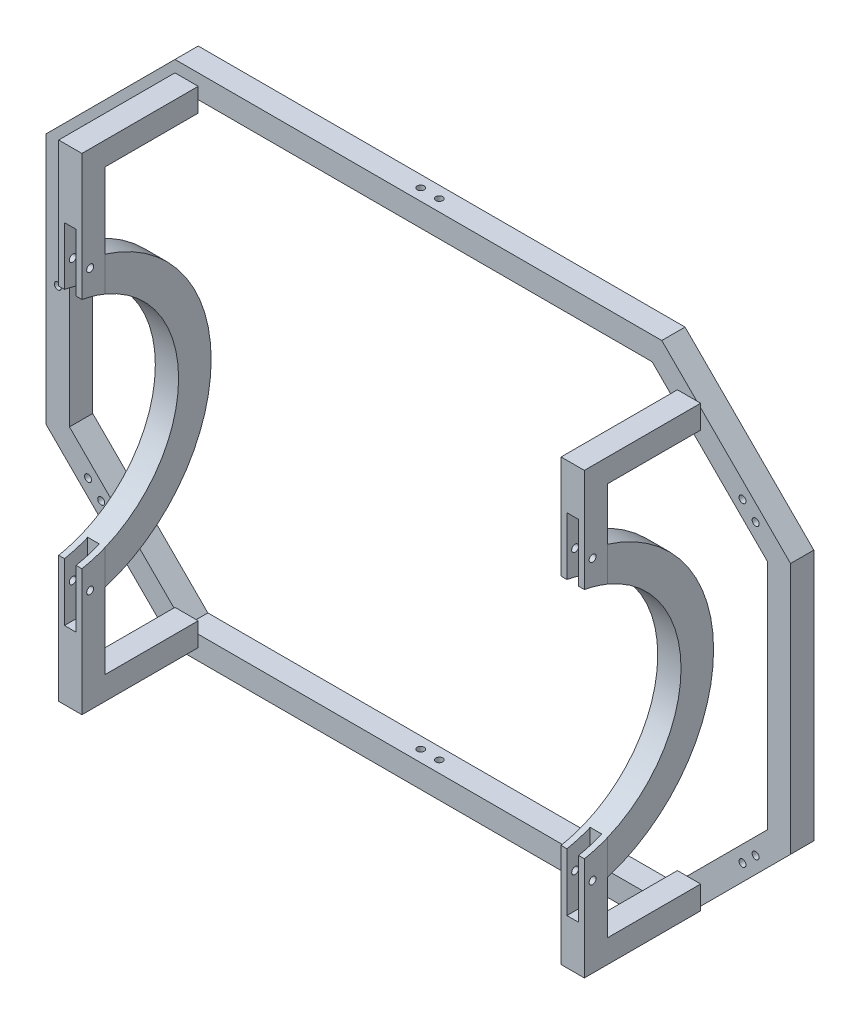
from build123d import *

# Parameters (mm, degrees)
Y_KSEKLIK_EKSTR_ZYON2_DEPTH = 10
IZIM3_W                     = 10
IZIM3_H                     = 40
Y_KSEKLIK_EKSTR_ZYON3_DEPTH = 10
IZIM4_W                     = 10
IZIM4_H                     = 104.5
Y_KSEKLIK_EKSTR_ZYON4_DEPTH = 10
IZIM6_W                     = 10
IZIM6_H                     = 50
Y_KSEKLIK_EKSTR_ZYON5_DEPTH = 10
IZIM7_W                     = 10
IZIM7_H                     = 94.5
Y_KSEKLIK_EKSTR_ZYON6_DEPTH = 10
IZIM8_R                     = 1.5
KES_EKSTR_ZYON1_DEPTH       = 35
IZIM9_R                     = 1.5
KES_EKSTR_ZYON2_DEPTH       = 265.5
IZIM12_R                    = 51
KES_EKSTR_ZYON4_DEPTH       = 338
Y_KSEKLIK_EKSTR_ZYON7_DEPTH = 5
Y_KSEKLIK_EKSTR_ZYON8_DEPTH = 5
IZIM21_W                    = 13.275114184
IZIM21_H                    = 150
KES_EKSTR_ZYON5_DEPTH       = 2.5
IZIM22_W                    = 15.470706389
IZIM22_H                    = 150
KES_EKSTR_ZYON6_DEPTH       = 2.5
IZIM23_R                    = 1.5
KES_EKSTR_ZYON7_DEPTH       = 242


with BuildPart() as part:
    # Çizim1 → Yükseklik-Ekstrüzyon2 (new body)
    with BuildSketch(Plane.XY):
        Polygon((-160, 54.142135624), (-104.644660941, 109.497474683), (104.644660941, 109.497474683), (160, 54.142135624), (160, -54.142135624), (104.644660941, -109.497474683), (-104.644660941, -109.497474683), (-160, -54.142135624), align=None)
        Polygon((-150, 50), (-150, -50), (-100.502525317, -99.497474683), (100.502525317, -99.497474683), (150, -50), (150, 50), (100.502525317, 99.497474683), (-100.502525317, 99.497474683), align=None, mode=Mode.SUBTRACT)
    extrude(amount=Y_KSEKLIK_EKSTR_ZYON2_DEPTH)

    # Çizim3 → Yükseklik-Ekstrüzyon3 (add)
    with BuildSketch(Plane(origin=(0, -104.5, 0), x_dir=(1, 0, 0), z_dir=(0, 1, 0))):
        with Locations((-99.644660941, -30)):
            Rectangle(IZIM3_W, IZIM3_H)
    y_kseklik_ekstr_zyon3 = extrude(amount=Y_KSEKLIK_EKSTR_ZYON3_DEPTH)

    # Çizim4 → Yükseklik-Ekstrüzyon4 (add)
    with BuildSketch(Plane.XY.offset(50)):
        with Locations((-99.644660941, -52.25)):
            Rectangle(IZIM4_W, IZIM4_H)
    y_kseklik_ekstr_zyon4 = extrude(amount=Y_KSEKLIK_EKSTR_ZYON4_DEPTH)

    # Çizim6 → Yükseklik-Ekstrüzyon5 (add)
    with BuildSketch(Plane(origin=(0, -94.5, 0), x_dir=(1, 0, 0), z_dir=(0, 1, 0))):
        with Locations((116.355339059, -35)):
            Rectangle(IZIM6_W, IZIM6_H)
    y_kseklik_ekstr_zyon5 = extrude(amount=Y_KSEKLIK_EKSTR_ZYON5_DEPTH)

    # Çizim7 → Yükseklik-Ekstrüzyon6 (add)
    with BuildSketch(Plane.XY.offset(50)):
        with Locations((116.355339059, -47.25)):
            Rectangle(IZIM7_W, IZIM7_H)
    y_kseklik_ekstr_zyon6 = extrude(amount=Y_KSEKLIK_EKSTR_ZYON6_DEPTH)

    # Aynalama1: Yükseklik-Ekstrüzyon3, Yükseklik-Ekstrüzyon4, Yükseklik-Ekstrüzyon5, Yükseklik-Ekstrüzyon6 across plane
    add(y_kseklik_ekstr_zyon3.mirror(Plane.ZX))
    add(y_kseklik_ekstr_zyon4.mirror(Plane.ZX))
    add(y_kseklik_ekstr_zyon5.mirror(Plane.ZX))
    add(y_kseklik_ekstr_zyon6.mirror(Plane.ZX))

    # Çizim8 → Kes-Ekstrüzyon1 (cut)
    with BuildSketch(Plane.XY.offset(10)):
        with Locations((145, 62.071067812)):
            Circle(IZIM8_R)
        with Locations((139.343145751, 67.727922061)):
            Circle(IZIM8_R)
        with Locations((139.343145751, -67.727922061)):
            Circle(IZIM8_R)
        with Locations((145, -62.071067812)):
            Circle(IZIM8_R)
        with Locations((-136.343145751, 70.727922061)):
            Circle(IZIM8_R)
        with Locations((-142, 65.071067812)):
            Circle(IZIM8_R)
        with Locations((-136.343145751, -70.727922061)):
            Circle(IZIM8_R)
        with Locations((-142, -65.071067812)):
            Circle(IZIM8_R)
        with Locations((-155, 0)):
            Circle(IZIM8_R)
    extrude(amount=-KES_EKSTR_ZYON1_DEPTH, mode=Mode.SUBTRACT)

    # Çizim9 → Kes-Ekstrüzyon2 (cut, symmetric)
    with BuildSketch(Plane(origin=(0, -94.5, 0), x_dir=(1, 0, 0), z_dir=(0, 1, 0))):
        with Locations(Location((-4, -4.992750184, 0), (0, 0, 90))):
            Circle(IZIM9_R)
        with Locations(Location((4, -4.992750184, 0), (0, 0, 90))):
            Circle(IZIM9_R)
    extrude(amount=KES_EKSTR_ZYON2_DEPTH, both=True, mode=Mode.SUBTRACT)

    # Çizim12 → Kes-Ekstrüzyon4 (cut, symmetric)
    with BuildSketch(Plane(origin=(-99.64, 0, 0), x_dir=(0, 0, -1), z_dir=(1, 0, 0))):
        with Locations((-69.443489697, 0)):
            Circle(IZIM12_R)
    extrude(amount=KES_EKSTR_ZYON4_DEPTH, both=True, mode=Mode.SUBTRACT)

    # Çizim19 → Yükseklik-Ekstrüzyon7 (add, symmetric)
    with BuildSketch(Plane(origin=(-99.64, 0, 0), x_dir=(0, 0, -1), z_dir=(1, 0, 0))):
        with BuildLine():
            Line((-50, -62.023791471), (-50, -47.148178209))
            ThreePointArc((-50, -47.148178209), (-18.443489697, 0), (-50, 47.148178209))
            Line((-50, 47.148178209), (-50, 62.023791471))
            ThreePointArc((-50, 62.023791471), (-4.443489697, 0), (-50, -62.023791471))
        make_face()
    extrude(amount=Y_KSEKLIK_EKSTR_ZYON7_DEPTH, both=True)

    # Çizim20 → Yükseklik-Ekstrüzyon8 (add, symmetric)
    with BuildSketch(Plane(origin=(116.36, 0, 0), x_dir=(0, 0, -1), z_dir=(1, 0, 0))):
        with BuildLine():
            Line((-50, -47.148178209), (-50, -62.023791471))
            ThreePointArc((-50, -62.023791471), (-4.443489697, 0), (-50, 62.023791471))
            Line((-50, 62.023791471), (-50, 47.148178209))
            ThreePointArc((-50, 47.148178209), (-18.443489697, 0), (-50, -47.148178209))
        make_face()
    extrude(amount=Y_KSEKLIK_EKSTR_ZYON8_DEPTH, both=True)

    # Çizim21 → Kes-Ekstrüzyon5 (cut, symmetric)
    with BuildSketch(Plane(origin=(-99.64, 0, 0), x_dir=(0, 0, -1), z_dir=(1, 0, 0))):
        with Locations((-56.637557092, 0)):
            Rectangle(IZIM21_W, IZIM21_H)
    extrude(amount=KES_EKSTR_ZYON5_DEPTH, both=True, mode=Mode.SUBTRACT)

    # Çizim22 → Kes-Ekstrüzyon6 (cut, symmetric)
    with BuildSketch(Plane(origin=(116.36, 0, 0), x_dir=(0, 0, -1), z_dir=(1, 0, 0))):
        with Locations((-57.735353195, 0)):
            Rectangle(IZIM22_W, IZIM22_H)
    extrude(amount=KES_EKSTR_ZYON6_DEPTH, both=True, mode=Mode.SUBTRACT)

    # Çizim23 → Kes-Ekstrüzyon7 (cut, symmetric)
    with BuildSketch(Plane(origin=(-99.64, 0, 0), x_dir=(0, 0, -1), z_dir=(1, 0, 0))):
        with Locations((-56.443489697, 60)):
            Circle(IZIM23_R)
        with Locations((-56.443489697, -60)):
            Circle(IZIM23_R)
    extrude(amount=KES_EKSTR_ZYON7_DEPTH, both=True, mode=Mode.SUBTRACT)


solid = part.part
